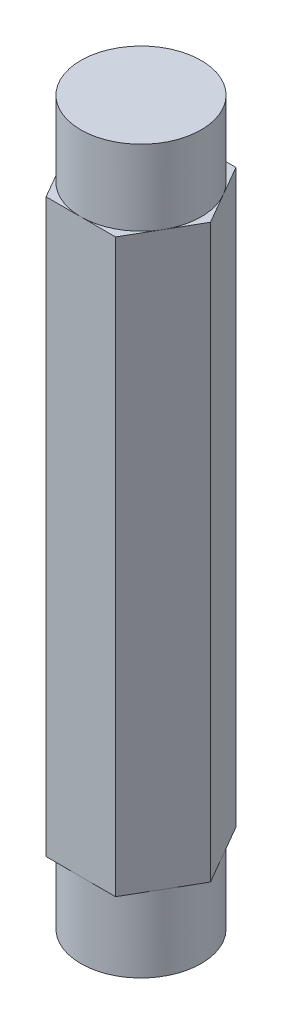
from build123d import *

# Parameters (mm, degrees)
BOSS_EXTRUDE1_DEPTH = 38.1
SKETCH2_OUTSIDE_W   = 32.39
SKETCH2_OUTSIDE_H   = 30.426
SKETCH2_OUTSIDE_R   = 6.35
CUT_EXTRUDE1_DEPTH  = 7.9502


with BuildPart() as part:
    # Sketch1 → Boss-Extrude1 (new, symmetric)
    with BuildSketch(Plane(origin=(0, 0, 0), x_dir=(1, 0, 0), z_dir=(0, 1, 0))):
        Polygon((3.666174209, -6.35), (7.332348419, 0), (3.666174209, 6.35), (-3.666174209, 6.35), (-7.332348419, 0), (-3.666174209, -6.35), align=None)
    extrude(amount=BOSS_EXTRUDE1_DEPTH, both=True)

    # Sketch2 outside → Cut-Extrude1 (cut)
    with BuildSketch(Plane(origin=(0, 38.1, 0), x_dir=(1, 0, 0), z_dir=(0, 1, 0))):
        Rectangle(SKETCH2_OUTSIDE_W, SKETCH2_OUTSIDE_H)
        with Locations(Location((0, 0, 0), (0, 0, 270))):
            Circle(SKETCH2_OUTSIDE_R, mode=Mode.SUBTRACT)
    cut_extrude1 = extrude(amount=-CUT_EXTRUDE1_DEPTH, mode=Mode.SUBTRACT)

    # Mirror1: Cut-Extrude1 across plane
    add(cut_extrude1.mirror(Plane.ZX), mode=Mode.SUBTRACT)


solid = part.part
